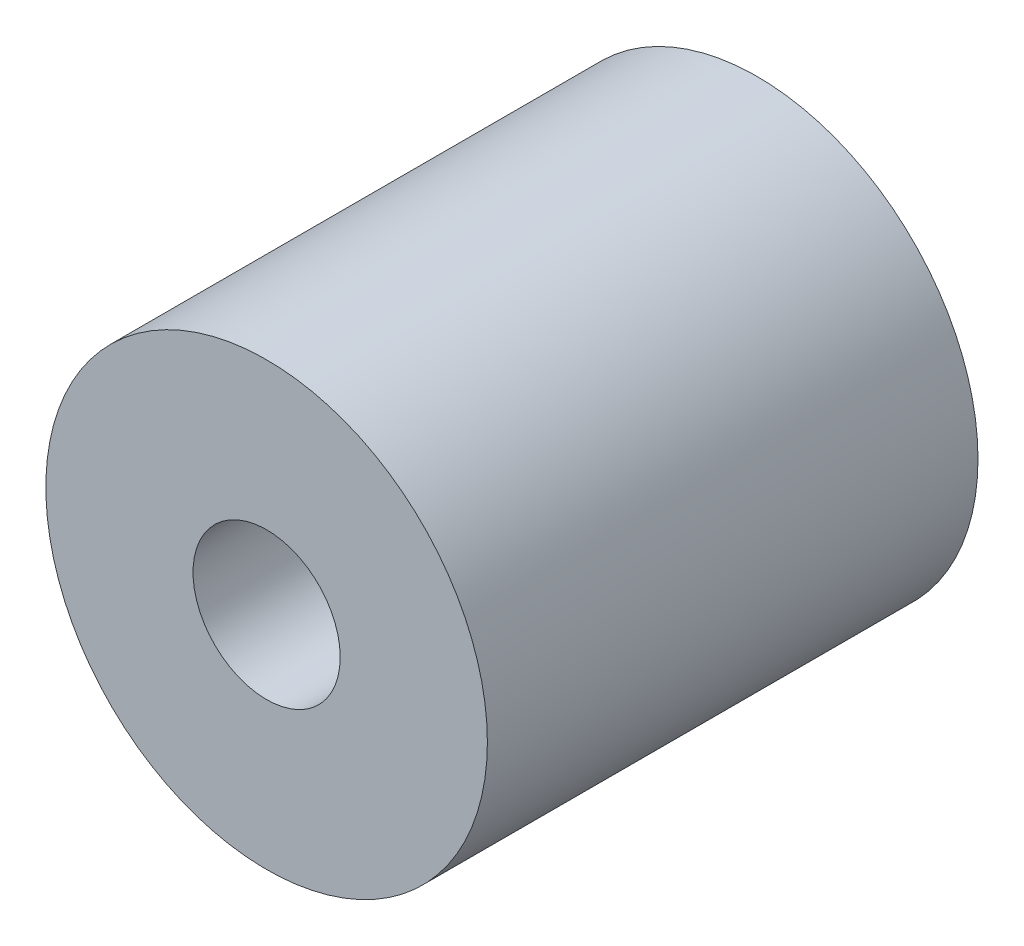
from build123d import *

# Parameters (mm, degrees)
SKETCH_1_R      = 4.5
SKETCH_1_R_2    = 1.5
EXTRUDE_1_DEPTH = 10


with BuildPart() as part:
    # 草图1 → 凸台-拉伸1 (new body)
    with BuildSketch(Plane.XY):
        Circle(SKETCH_1_R)
        Circle(SKETCH_1_R_2, mode=Mode.SUBTRACT)
    extrude(amount=EXTRUDE_1_DEPTH)


solid = part.part
